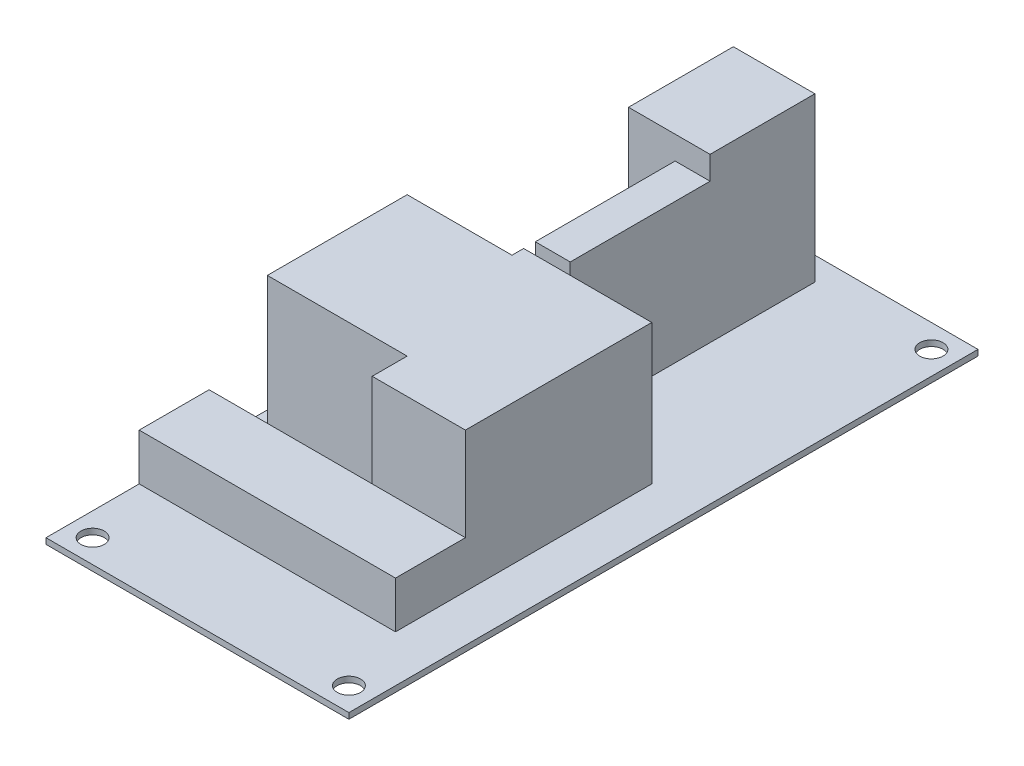
from build123d import *

# Parameters (mm, degrees)
SKETCH1_W           = 41.275
SKETCH1_H           = 85.725
BOSS_EXTRUDE1_DEPTH = 0.79375
SKETCH2_W           = 34.925
SKETCH2_H           = 9.525
BOSS_EXTRUDE2_DEPTH = 6.35
BOSS_EXTRUDE3_DEPTH = 19.05
SKETCH4_W           = 11.1125
SKETCH4_H           = 11.1125
BOSS_EXTRUDE4_DEPTH = 6.35
SKETCH5_R           = 2.38125
BOSS_EXTRUDE5_DEPTH = 3.175
SKETCH6_W           = 4.7625
SKETCH6_H           = 19.05
BOSS_EXTRUDE6_DEPTH = 19.05
SKETCH7_W           = 11.1125
SKETCH7_H           = 14.2875
BOSS_EXTRUDE7_DEPTH = 22.225
SKETCH8_R           = 1.5875
CUT_EXTRUDE1_DEPTH  = 53.507627422


with BuildPart() as part:
    # Sketch1 → Boss-Extrude1 (new body)
    with BuildSketch(Plane(origin=(0, 0, 0), x_dir=(1, 0, 0), z_dir=(0, 1, 0))):
        Rectangle(SKETCH1_W, SKETCH1_H)
    extrude(amount=BOSS_EXTRUDE1_DEPTH)

    # Sketch2 → Boss-Extrude2 (add)
    with BuildSketch(Plane(origin=(0, 0.79375, 0), x_dir=(1, 0, 0), z_dir=(0, 1, 0))):
        with Locations((-3.175, -25.4)):
            Rectangle(SKETCH2_W, SKETCH2_H)
    extrude(amount=BOSS_EXTRUDE2_DEPTH)

    # Sketch3 → Boss-Extrude3 (add)
    with BuildSketch(Plane(origin=(0, 0.79375, 0), x_dir=(1, 0, 0), z_dir=(0, 1, 0))):
        Polygon((14.2875, -20.6375), (14.2875, 4.7625), (-3.175, 4.7625), (-3.175, 3.175), (-17.4625, 3.175), (-17.4625, -15.875), (1.5875, -15.875), (1.5875, -20.6375), align=None)
    extrude(amount=BOSS_EXTRUDE3_DEPTH)

    # Sketch4 → Boss-Extrude4 (add)
    with BuildSketch(Plane(origin=(0, 0.79375, 0), x_dir=(1, 0, 0), z_dir=(0, 1, 0))):
        with Locations((-8.73125, 15.08125)):
            Rectangle(SKETCH4_W, SKETCH4_H)
    extrude(amount=BOSS_EXTRUDE4_DEPTH)

    # Sketch5 → Boss-Extrude5 (add)
    with BuildSketch(Plane(origin=(0, 7.14375, 0), x_dir=(1, 0, 0), z_dir=(0, 1, 0))):
        with Locations(Location((-8.73125, 15.08125, 0), (0, 0, 270))):
            Circle(SKETCH5_R)
    extrude(amount=BOSS_EXTRUDE5_DEPTH)

    # Sketch6 → Boss-Extrude6 (add)
    with BuildSketch(Plane(origin=(0, 0.79375, 0), x_dir=(1, 0, 0), z_dir=(0, 1, 0))):
        with Locations((-0.79375, 15.875)):
            Rectangle(SKETCH6_W, SKETCH6_H)
    extrude(amount=BOSS_EXTRUDE6_DEPTH)

    # Sketch7 → Boss-Extrude7 (add)
    with BuildSketch(Plane(origin=(0, 0.79375, 0), x_dir=(1, 0, 0), z_dir=(0, 1, 0))):
        with Locations((-3.96875, 32.54375)):
            Rectangle(SKETCH7_W, SKETCH7_H)
    extrude(amount=BOSS_EXTRUDE7_DEPTH)

    # Sketch8 → Cut-Extrude1 (cut, through all)
    with BuildSketch(Plane(origin=(0, 0.79375, 0), x_dir=(1, 0, 0), z_dir=(0, 1, 0))):
        with Locations(Location((-17.4625, 39.6875, 0), (0, 0, 270))):
            Circle(SKETCH8_R)
        with Locations(Location((17.4625, 39.6875, 0), (0, 0, 270))):
            Circle(SKETCH8_R)
        with Locations(Location((-17.4625, -39.6875, 0), (0, 0, 270))):
            Circle(SKETCH8_R)
        with Locations(Location((17.4625, -39.6875, 0), (0, 0, 270))):
            Circle(SKETCH8_R)
    extrude(amount=-CUT_EXTRUDE1_DEPTH, mode=Mode.SUBTRACT)


solid = part.part
